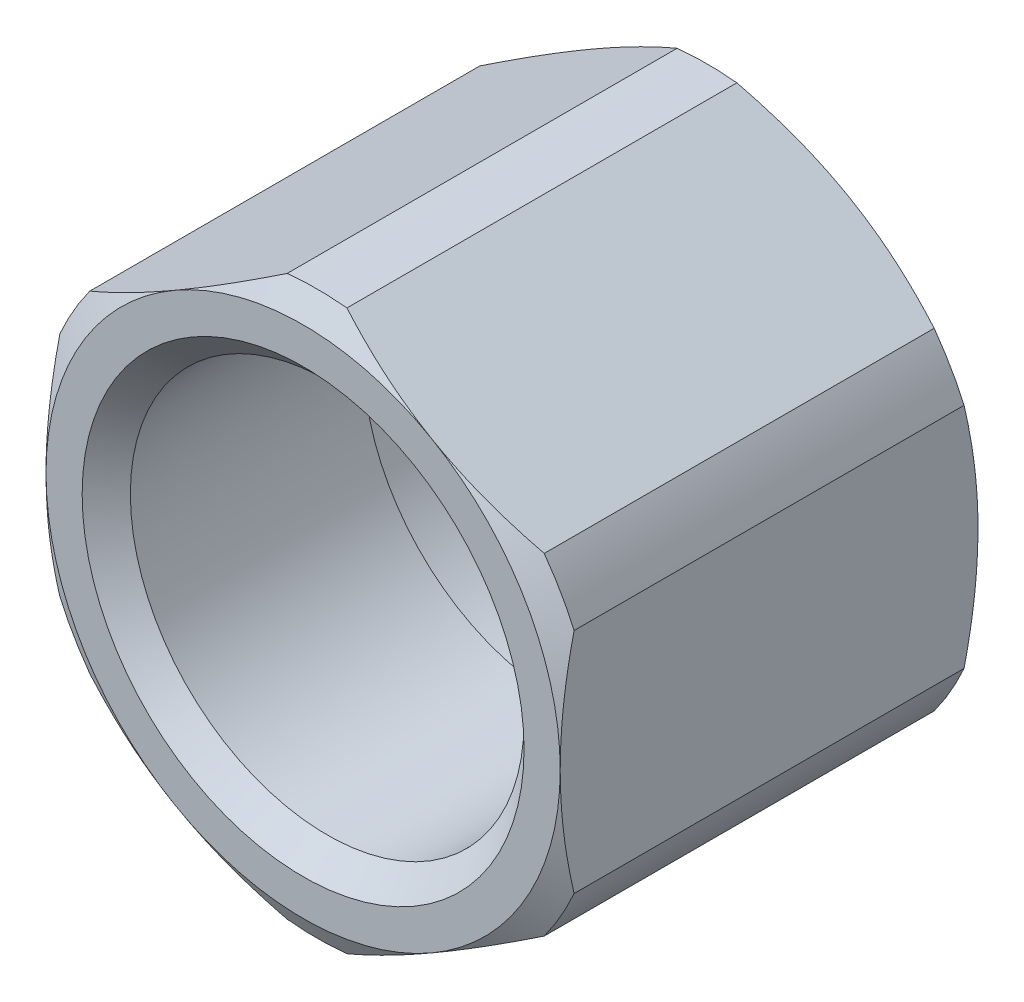
from build123d import *

# Parameters (mm, degrees)
SKETCH_1_R          = 12.25
EXTRUDE_1_DEPTH     = 26
SKETCH_7_OUTSIDE_W  = 45.074
SKETCH_7_OUTSIDE_H  = 50.024
SKETCH_7_OUTSIDE_R  = 17.5
CUT_EXTRUDE_2_DEPTH = 36.68379651
CHAMFER_1_SIZE      = 1.5


with BuildPart() as part:
    # Эскиз1 → Бобышка-Вытянуть1 (new body)
    with BuildSketch(Plane.XY):
        Polygon((0, 18.475208614), (-16, 9.237604307), (-16, -9.237604307), (0, -18.475208614), (16, -9.237604307), (16, 9.237604307), align=None)
        with Locations(Location((0, 0, 0), (0, 0, 180))):
            Circle(SKETCH_1_R, mode=Mode.SUBTRACT)
    extrude(amount=EXTRUDE_1_DEPTH)

    # Эскиз2 → Вырез-Повернуть1 (revolve, cut)
    with BuildSketch(Plane(origin=(0, 0, 0), x_dir=(0, 0, -1), z_dir=(1, 0, 0))):
        Polygon((0, 19.828002546), (-2.210098301, 19.828002546), (0, 16), align=None)
        Polygon((-23.789901699, 19.828002546), (-26, 16), (-26, 19.828002546), align=None)
    revolve(axis=Axis((0, 0, 0), (0, 0, 1)), mode=Mode.SUBTRACT)

    # Эскиз7 outside → Вырез-Вытянуть2 (cut, through all)
    with BuildSketch(Plane.XY.offset(26)):
        Rectangle(SKETCH_7_OUTSIDE_W, SKETCH_7_OUTSIDE_H)
        Circle(SKETCH_7_OUTSIDE_R, mode=Mode.SUBTRACT)
    extrude(amount=-CUT_EXTRUDE_2_DEPTH, mode=Mode.SUBTRACT)

    # Эскиз3 → Вырез-Повернуть2 (revolve, cut)
    with BuildSketch(Plane(origin=(0, 0, 0), x_dir=(0, 0, -1), z_dir=(1, 0, 0)), mode=Mode.PRIVATE) as cut_revolve_2_sk:
        with BuildLine():
            Line((-9.5, 13.1), (-11.145448267, 10.25))
            Line((-11.145448267, 10.25), (0.758835928, 10.25))
            Line((0.758835928, 10.25), (0.758835928, 13.832407636))
            Line((0.758835928, 13.832407636), (-4.111314003, 12.25))
            Line((-4.111314003, 12.25), (-5.511314003, 12.25))
            ThreePointArc((-5.511314003, 12.25), (-5.848079759, 12.858287544), (-6.5, 13.1))
            Line((-6.5, 13.1), (-9.5, 13.1))
        make_face()
    revolve(cut_revolve_2_sk.sketch.rotate(Axis((0, 0, 0), (0, 0, 1)), 90), axis=Axis((0, 0, 0), (0, 0, 1)), mode=Mode.SUBTRACT)

    # Фаска1
    chamfer_1_edges = [part.edges().sort_by_distance(p)[0] for p in [
        (12.25, 0, 26),
    ]]
    chamfer(chamfer_1_edges, length=CHAMFER_1_SIZE)


solid = part.part
